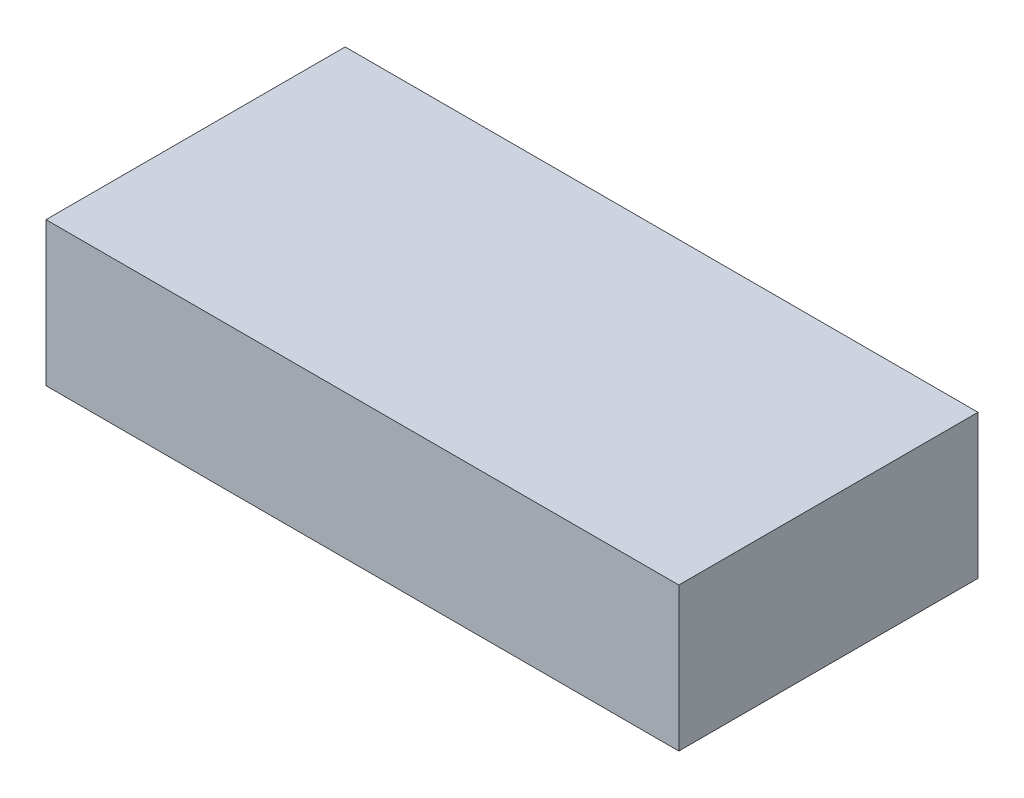
from build123d import *

# Parameters (mm, degrees)
ESQUISSE1_W        = 110
ESQUISSE1_H        = 52
BOSS_EXTRU_1_DEPTH = 25


with BuildPart() as part:
    # Esquisse1 → Boss.-Extru.1 (new body)
    with BuildSketch(Plane(origin=(0, 0, 0), x_dir=(1, 0, 0), z_dir=(0, 1, 0))):
        Rectangle(ESQUISSE1_W, ESQUISSE1_H)
    extrude(amount=BOSS_EXTRU_1_DEPTH)


solid = part.part
